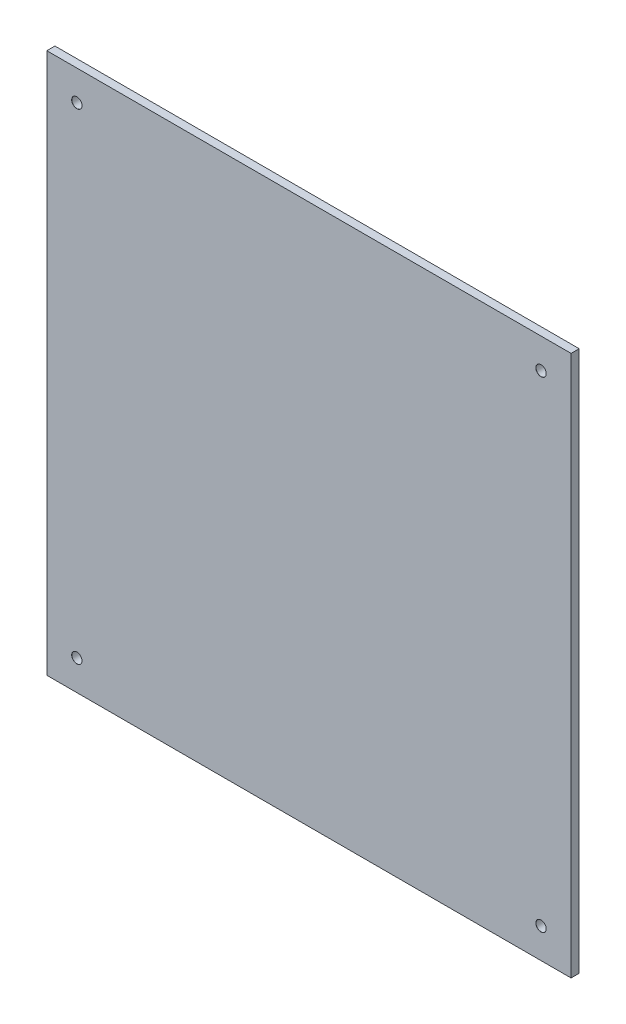
from build123d import *

# Parameters (mm, degrees)
SKETCH1_W                      = 174.457332138
SKETCH1_H                      = 180
BOSS_EXTRUDE1_DEPTH            = 2.7
M3_CLEARANCE_HOLE1_D           = 3.4
M3_CLEARANCE_HOLE1_CSINK_D     = 3.45
M3_CLEARANCE_HOLE1_CSINK_ANGLE = 90


with BuildPart() as part:
    # Sketch1 → Boss-Extrude1 (new body)
    with BuildSketch(Plane.XY):
        with Locations((162.771333931, -80)):
            Rectangle(SKETCH1_W, SKETCH1_H)
    extrude(amount=BOSS_EXTRUDE1_DEPTH)

    # M3 Clearance Hole1 (through all)
    with Locations(Plane(origin=(85.542667862, 0, 2.7), x_dir=(1, 0, 0), z_dir=(0, 0, 1))):
        with Locations((0, 0), (0, -160), (154.457332138, -160), (154.457332138, 0)):
            CounterSinkHole(M3_CLEARANCE_HOLE1_D / 2, M3_CLEARANCE_HOLE1_CSINK_D / 2, counter_sink_angle=M3_CLEARANCE_HOLE1_CSINK_ANGLE)


solid = part.part
